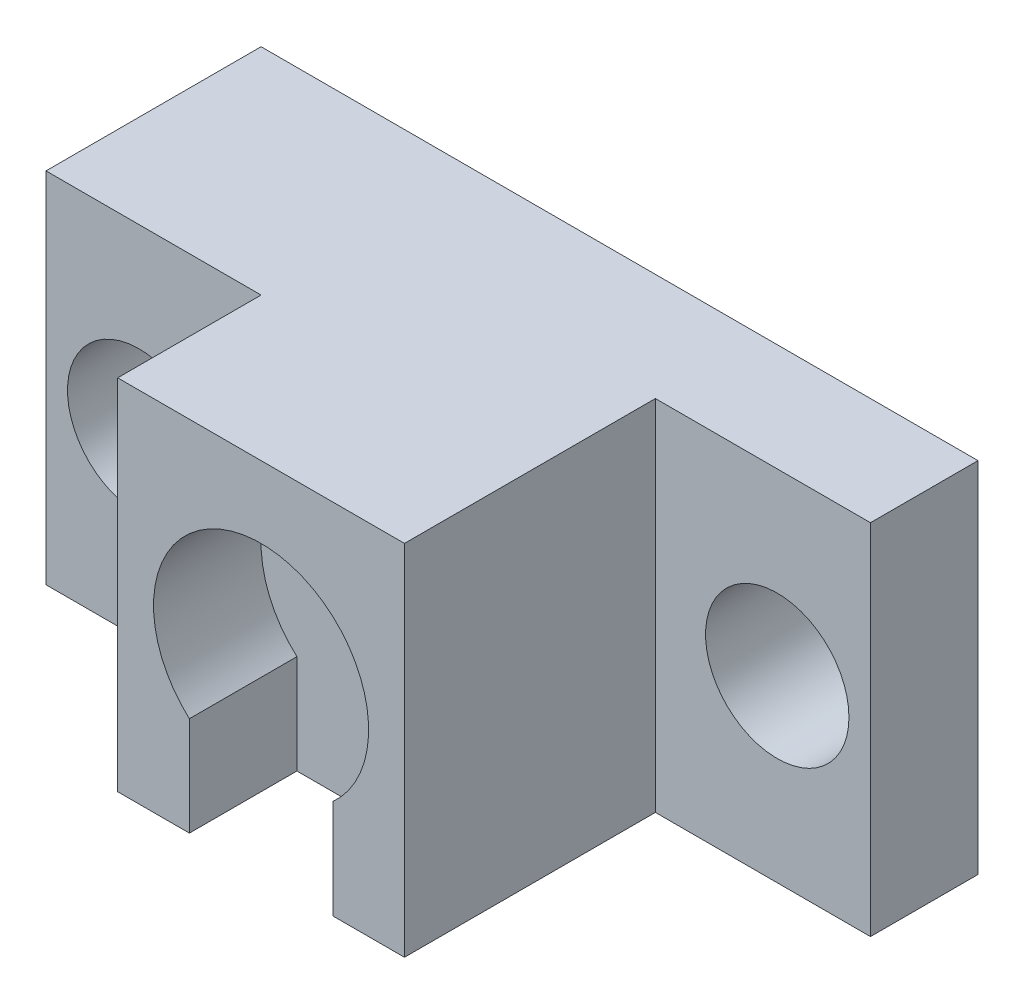
from build123d import *

# Parameters (mm, degrees)
SKETCH1_W           = 40
SKETCH1_H           = 50
BOSS_EXTRUDE1_DEPTH = 50
SKETCH1_3_W         = 30
SKETCH1_3_H         = 50
BOSS_EXTRUDE2_DEPTH = 30
SKETCH1_4_W         = 30
SKETCH1_4_H         = 50
BOSS_EXTRUDE3_DEPTH = 15
CUT_EXTRUDE1_DEPTH  = 15
SKETCH3_R           = 10
CUT_EXTRUDE2_DEPTH  = 84.208751563


with BuildPart() as part:
    # Sketch1 → Boss-Extrude1 (new body)
    with BuildSketch(Plane.XY):
        with Locations((0, 34.360730594)):
            Rectangle(SKETCH1_W, SKETCH1_H)
    extrude(amount=BOSS_EXTRUDE1_DEPTH)

    # Sketch1<3> → Boss-Extrude2 (add)
    with BuildSketch(Plane.XY):
        with Locations((-35, 34.360730594)):
            Rectangle(SKETCH1_3_W, SKETCH1_3_H)
    extrude(amount=BOSS_EXTRUDE2_DEPTH)

    # Sketch1<4> → Boss-Extrude3 (add)
    with BuildSketch(Plane.XY):
        with Locations((35, 34.360730594)):
            Rectangle(SKETCH1_4_W, SKETCH1_4_H)
    extrude(amount=BOSS_EXTRUDE3_DEPTH)

    # Sketch2 → Cut-Extrude1 (cut)
    with BuildSketch(Plane.XY.offset(50)):
        with BuildLine():
            Line((-10, 23.180390706), (-10, 9.360730594))
            Line((-10, 9.360730594), (10, 9.360730594))
            Line((10, 9.360730594), (10, 23.180390706))
            ThreePointArc((10, 23.180390706), (0, 49.360730594), (-10, 23.180390706))
        make_face()
    extrude(amount=-CUT_EXTRUDE1_DEPTH, mode=Mode.SUBTRACT)

    # Sketch3 → Cut-Extrude2 (cut, through all)
    with BuildSketch(Plane.XY.offset(30)):
        with Locations((-37, 34.360730594)):
            Circle(SKETCH3_R)
        with Locations((37, 34.360730594)):
            Circle(SKETCH3_R)
    extrude(amount=-CUT_EXTRUDE2_DEPTH, mode=Mode.SUBTRACT)


solid = part.part
